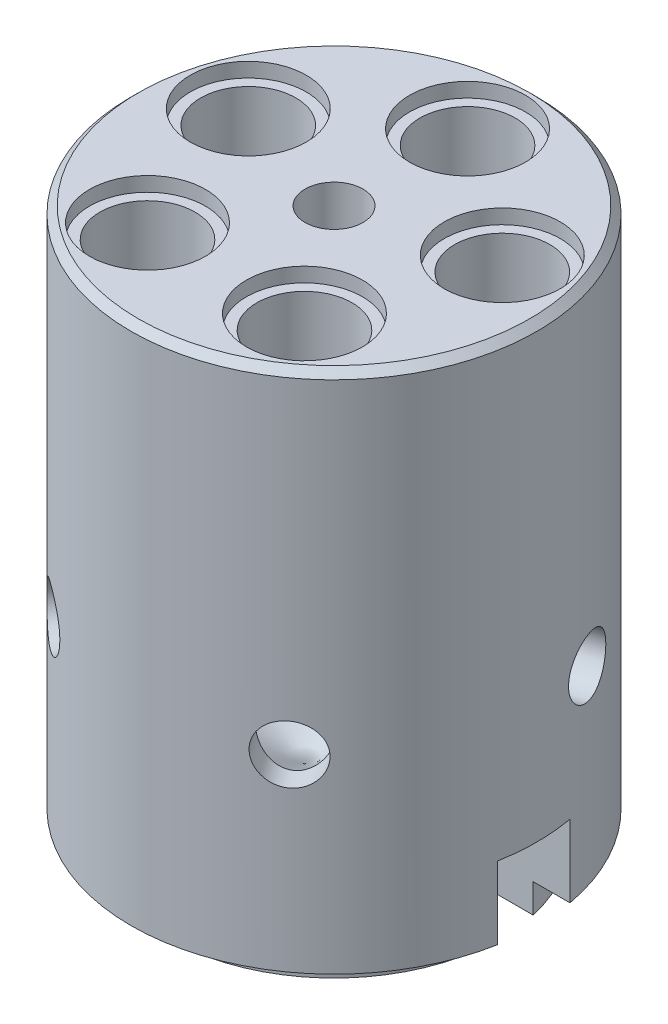
from build123d import *

# Parameters (mm, degrees)
ESQUISSE1_W                  = 14
ESQUISSE1_H                  = 38
ESQUISSE2_R                  = 2
ENL_V_MAT_EXTRU_1_DEPTH      = 43.848570571
R_P_TITION_CIRCULAIRE1_COUNT = 5
CHANFREIN1_SIZE              = 0.5
ESQUISSE5_R                  = 15
ESQUISSE5_R_2                = 11.5
ENL_V_MAT_EXTRU_2_DEPTH      = 2
ESQUISSE7_W                  = 32
ESQUISSE7_H                  = 5
ENL_V_MAT_EXTRU_3_DEPTH      = 7
ENL_V_MAT_EXTRU_4_REACH      = 51.234
ENL_V_MAT_EXTRU_4_END_RADIUS = 3.285
ESQUISSE8_R                  = 2
R_P_TITION_CIRCULAIRE2_COUNT = 5


with BuildPart() as part:
    # Esquisse1 → Révolution1 (revolve)
    with BuildSketch(Plane.XY, mode=Mode.PRIVATE) as r_volution1_sk:
        with Locations((7, 19)):
            Rectangle(ESQUISSE1_W, ESQUISSE1_H)
    revolve(r_volution1_sk.sketch.rotate(Axis((0, 0, 0), (0, 1, 0)), 90), axis=Axis((0, 0, 0), (0, 1, 0)))

    # Esquisse2 → Enlèv. mat.-Extru.1 (cut, through all)
    with BuildSketch(Plane(origin=(0, 38, 0), x_dir=(-1, 0, 0), z_dir=(0, 1, 0))):
        with Locations(Location((0, 0, 0), (0, 0, 90))):
            Circle(ESQUISSE2_R)
    extrude(amount=-ENL_V_MAT_EXTRU_1_DEPTH, mode=Mode.SUBTRACT)

    # Esquisse3 → Chambrage pour vis à tête hexagonale M51 (revolve, cut)
    with BuildSketch(Plane(origin=(0, 38, -9.21), x_dir=(0, 0, 1), z_dir=(1, 0, 0))):
        Polygon((0, 0), (0, 26.896595634), (3.285, 25), (3.285, 1), (4, 1), (4, 0), align=None)
    chambrage_pour_vis_t_te_hexagonale_m51 = revolve(axis=Axis((0, 44.35, -9.21), (0, -1, 0)), mode=Mode.SUBTRACT)

    # Répétition circulaire1: Chambrage pour vis à tête hexagonale M51 ×5 about axis
    r_p_tition_circulaire1_axis = Axis((0, 0, 0), (0, 1, 0))
    for i in range(1, R_P_TITION_CIRCULAIRE1_COUNT):
        add(chambrage_pour_vis_t_te_hexagonale_m51.rotate(r_p_tition_circulaire1_axis, i * 360 / R_P_TITION_CIRCULAIRE1_COUNT), mode=Mode.SUBTRACT)

    # Chanfrein1
    chanfrein1_edges = [part.edges().sort_by_distance(p)[0] for p in [
        (0, 38, 14),
    ]]
    chamfer(chanfrein1_edges, length=CHANFREIN1_SIZE)

    # Esquisse5 → Enlèv. mat.-Extru.2 (cut)
    with BuildSketch(Plane.XZ):
        Circle(ESQUISSE5_R)
        with Locations(Location((0, 0, 0), (0, 0, 270))):
            Circle(ESQUISSE5_R_2, mode=Mode.SUBTRACT)
    extrude(amount=-ENL_V_MAT_EXTRU_2_DEPTH, mode=Mode.SUBTRACT)

    # Esquisse7 → Enlèv. mat.-Extru.3 (cut)
    with BuildSketch(Plane.XZ):
        Rectangle(ESQUISSE7_W, ESQUISSE7_H)
    extrude(amount=-ENL_V_MAT_EXTRU_3_DEPTH, mode=Mode.SUBTRACT)

    # Enlèv. mat.-Extru.4: up to this cylinder (the profile starts outside it)
    enl_v_mat_extru_4_end = Plane(origin=(0, 15, -9.21), z_dir=(0, 1, 0)) * Cylinder(ENL_V_MAT_EXTRU_4_END_RADIUS, 110.038, mode=Mode.PRIVATE)
    # Esquisse8 → Enlèv. mat.-Extru.4 (cut, up to the surface)
    with BuildSketch(Plane(origin=(0, 0, -14), x_dir=(-1, 0, 0), z_dir=(0, 0, -1)), mode=Mode.PRIVATE) as enl_v_mat_extru_4_sk1:
        with Locations((0, 15)):
            Circle(ESQUISSE8_R)
    enl_v_mat_extru_4_tool1 = extrude(enl_v_mat_extru_4_sk1.sketch, amount=-ENL_V_MAT_EXTRU_4_REACH, mode=Mode.PRIVATE) - enl_v_mat_extru_4_end
    enl_v_mat_extru_4 = enl_v_mat_extru_4_tool1.solids().sort_by_distance((0, 15, -14))[0]
    add(enl_v_mat_extru_4, mode=Mode.SUBTRACT)

    # Répétition circulaire2: Enlèv. mat.-Extru.4 ×5 about axis
    r_p_tition_circulaire2_axis = Axis((0, 0, 0), (0, -1, 0))
    for i in range(1, R_P_TITION_CIRCULAIRE2_COUNT):
        add(enl_v_mat_extru_4.rotate(r_p_tition_circulaire2_axis, i * 360 / R_P_TITION_CIRCULAIRE2_COUNT), mode=Mode.SUBTRACT)


solid = part.part
